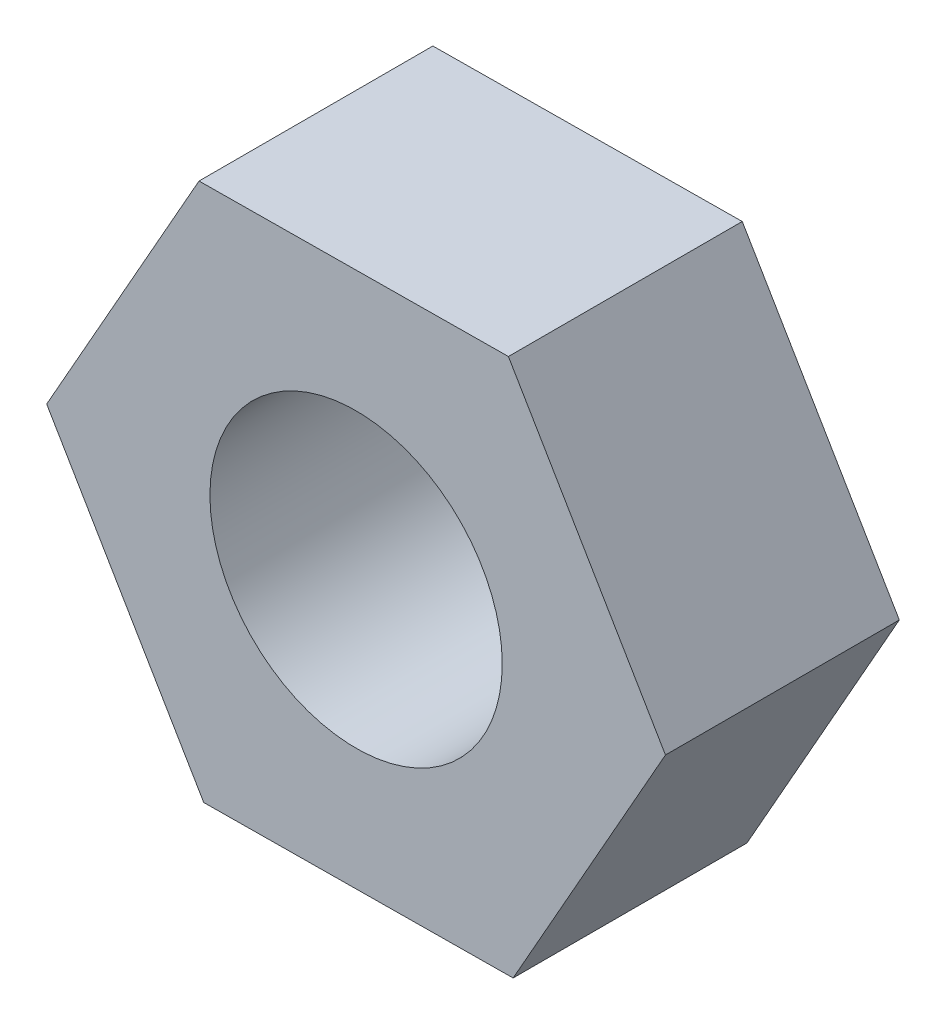
from build123d import *

# Parameters (mm, degrees)
SKETCH_1_R      = 1.5
EXTRUDE_1_DEPTH = 2.4


with BuildPart() as part:
    # 草图1 → 凸台-拉伸1 (new body)
    with BuildSketch(Plane.XY):
        Polygon((1.61185848, -2.735917684), (3.175303457, 0.027951549), (1.563444977, 2.763869233), (-1.61185848, 2.735917684), (-3.175303457, -0.027951549), (-1.563444977, -2.763869233), align=None)
        Circle(SKETCH_1_R, mode=Mode.SUBTRACT)
    extrude(amount=EXTRUDE_1_DEPTH)


solid = part.part
